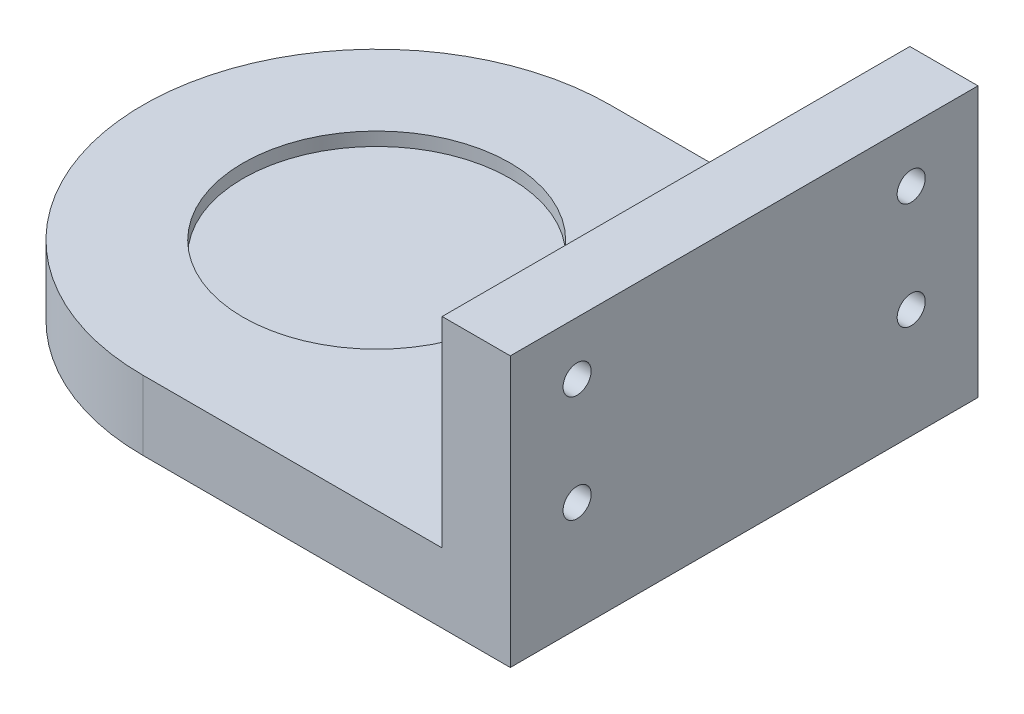
from build123d import *

# Parameters (mm, degrees)
EXTRUDE_1_DEPTH     = 10.4
SKETCH_2_W          = 10.2
SKETCH_2_H          = 70
EXTRUDE_2_DEPTH     = 30
SKETCH_3_R          = 2.1
CUT_EXTRUDE_3_DEPTH = 102.118742081
SKETCH_4_R          = 20
CUT_EXTRUDE_4_DEPTH = 2


with BuildPart() as part:
    # ｽｹｯﾁ1 → 押し出し1 (new body)
    with BuildSketch(Plane(origin=(0, 0, 0), x_dir=(1, 0, 0), z_dir=(0, 1, 0))):
        with BuildLine():
            Line((0, 35), (55, 35))
            Line((55, 35), (55, -35))
            Line((55, -35), (0, -35))
            ThreePointArc((0, -35), (-35, 0), (0, 35))
        make_face()
    extrude(amount=-EXTRUDE_1_DEPTH)

    # ｽｹｯﾁ2 → 押し出し2 (add)
    with BuildSketch(Plane(origin=(0, 0, 0), x_dir=(-1, 0, 0), z_dir=(0, -1, 0))):
        with Locations((-49.9, 0)):
            Rectangle(SKETCH_2_W, SKETCH_2_H)
    extrude(amount=-EXTRUDE_2_DEPTH)

    # ｽｹｯﾁ3 → 押し出し3 (cut, through all)
    with BuildSketch(Plane(origin=(55, 0, 0), x_dir=(0, 0, -1), z_dir=(1, 0, 0))):
        with Locations((25, 22)):
            Circle(SKETCH_3_R)
        with Locations((25, 6)):
            Circle(SKETCH_3_R)
        with Locations((-25, 6)):
            Circle(SKETCH_3_R)
        with Locations((-25, 22)):
            Circle(SKETCH_3_R)
    extrude(amount=-CUT_EXTRUDE_3_DEPTH, mode=Mode.SUBTRACT)

    # ｽｹｯﾁ4 → 押し出し4 (cut)
    with BuildSketch(Plane(origin=(0, 0, 0), x_dir=(1, 0, 0), z_dir=(0, 1, 0))):
        Circle(SKETCH_4_R)
    extrude(amount=-CUT_EXTRUDE_4_DEPTH, mode=Mode.SUBTRACT)


solid = part.part
